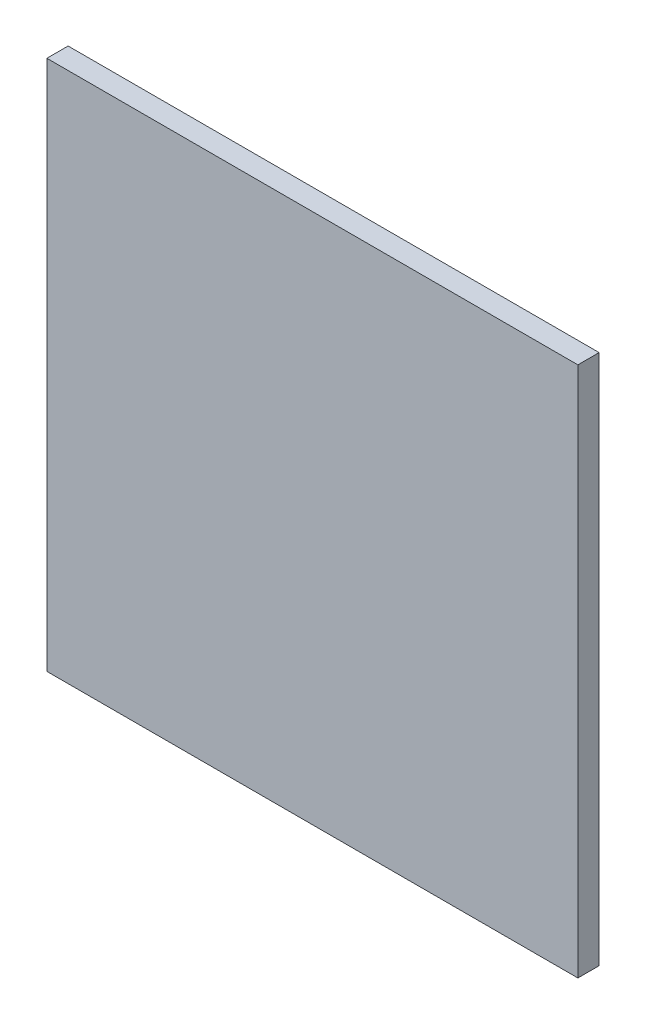
from build123d import *

# Parameters (mm, degrees)
SKETCH1_W           = 30
SKETCH1_H           = 30
BOSS_EXTRUDE1_DEPTH = 1.2


with BuildPart() as part:
    # Sketch1 → Boss-Extrude1 (new body)
    with BuildSketch(Plane.XY):
        with Locations((-8.322324561, 0.233315789)):
            Rectangle(SKETCH1_W, SKETCH1_H)
    extrude(amount=BOSS_EXTRUDE1_DEPTH)


solid = part.part
